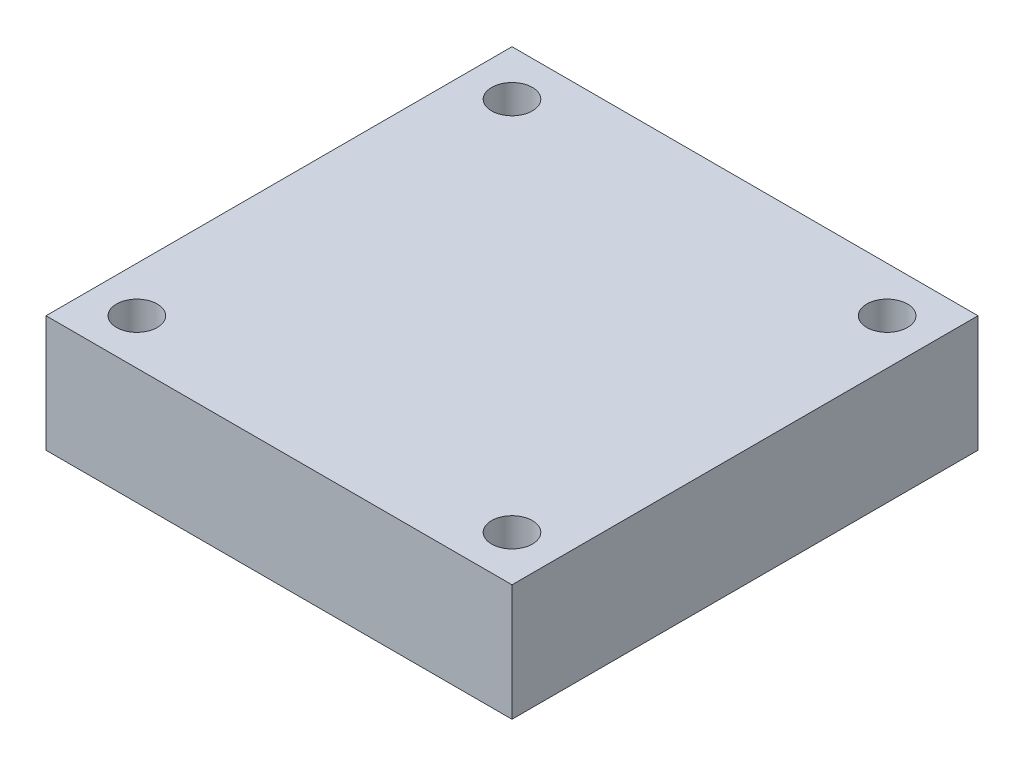
from build123d import *

# Parameters (mm, degrees)
SKETCH1_W           = 40
SKETCH1_H           = 40
BOSS_EXTRUDE1_DEPTH = 10
SKETCH2_R           = 1.75
CUT_EXTRUDE1_DEPTH  = 10


with BuildPart() as part:
    # Sketch1 → Boss-Extrude1 (new body)
    with BuildSketch(Plane(origin=(0, 0, 0), x_dir=(1, 0, 0), z_dir=(0, 1, 0))):
        with Locations((20, -20)):
            Rectangle(SKETCH1_W, SKETCH1_H)
    extrude(amount=BOSS_EXTRUDE1_DEPTH)

    # Sketch2 → Cut-Extrude1 (cut)
    with BuildSketch(Plane(origin=(0, 10, 0), x_dir=(1, 0, 0), z_dir=(0, 1, 0))):
        with Locations(Location((3.9, -3.9, 0), (0, 0, 270))):
            Circle(SKETCH2_R)
        with Locations(Location((36.1, -3.9, 0), (0, 0, 270))):
            Circle(SKETCH2_R)
        with Locations(Location((36.1, -36.1, 0), (0, 0, 270))):
            Circle(SKETCH2_R)
        with Locations(Location((3.9, -36.1, 0), (0, 0, 270))):
            Circle(SKETCH2_R)
    extrude(amount=-CUT_EXTRUDE1_DEPTH, mode=Mode.SUBTRACT)


solid = part.part
